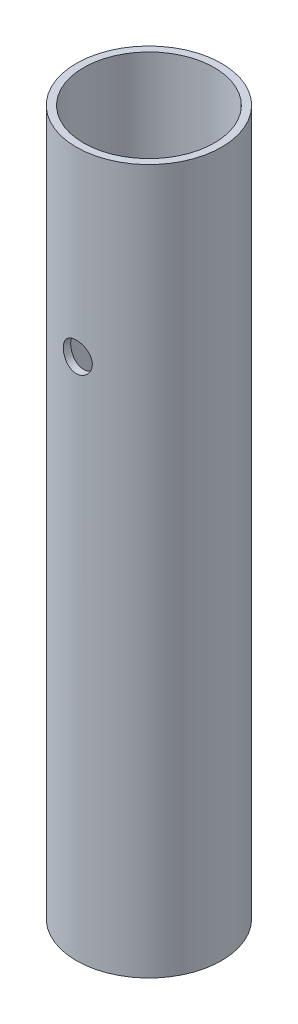
from build123d import *

# Parameters (mm, degrees)
SKETCH2_R               = 31.75
SKETCH2_R_2             = 28.575
BOSS_EXTRUDE1_DEPTH     = 307.975
CUT_EXTRUDE1_DEPTH      = 312.230984359
CUT_EXTRUDE1_DEPTH_BACK = 312.230984359
SKETCH3_R               = 6.35


with BuildPart() as part:
    # Sketch2 → Boss-Extrude1 (new body)
    with BuildSketch(Plane(origin=(0, 0, 0), x_dir=(1, 0, 0), z_dir=(0, 1, 0))):
        with Locations(Location((0, 0, 0), (0, 0, 270))):
            Circle(SKETCH2_R)
        with Locations(Location((0, 0, 0), (0, 0, 270))):
            Circle(SKETCH2_R_2, mode=Mode.SUBTRACT)
    extrude(amount=BOSS_EXTRUDE1_DEPTH)

    # Sketch3 → Cut-Extrude1 (cut, two sides: drawn at the far end of the back side and taken through both)
    with BuildSketch(Plane.XY.offset(-CUT_EXTRUDE1_DEPTH_BACK)):
        with Locations((0, 228.6)):
            Circle(SKETCH3_R)
    extrude(amount=CUT_EXTRUDE1_DEPTH + CUT_EXTRUDE1_DEPTH_BACK, mode=Mode.SUBTRACT)


solid = part.part
